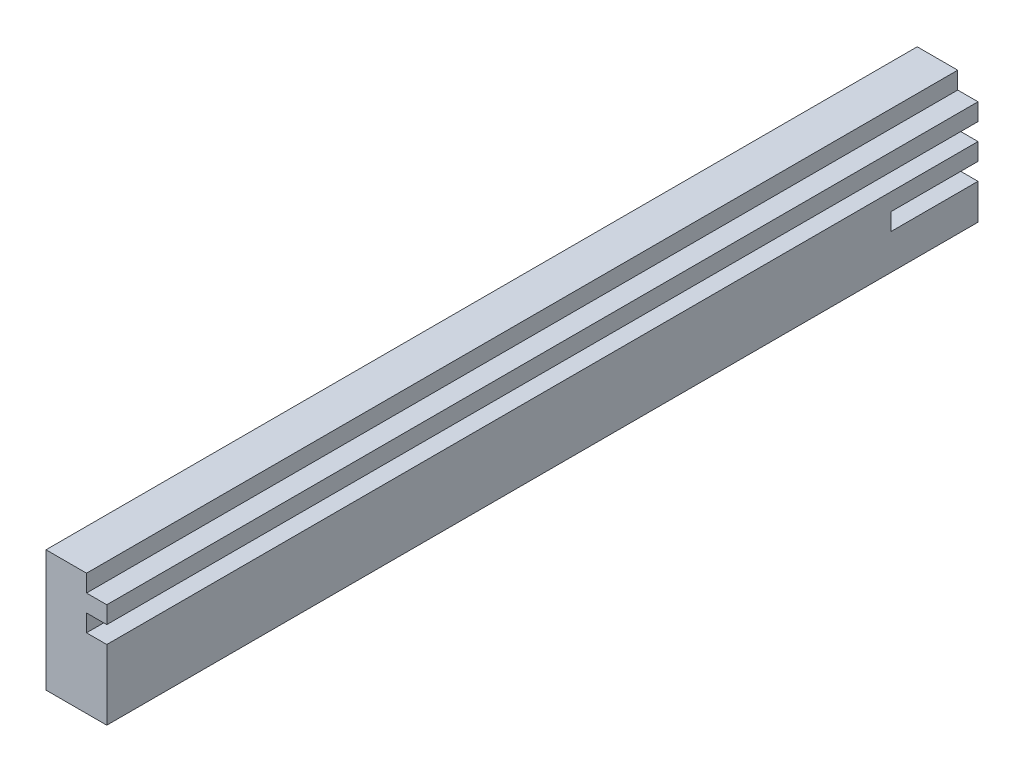
from build123d import *

# Parameters (mm, degrees)
SKETCH1_W           = 430
SKETCH1_H           = 60
BOSS_EXTRUDE1_DEPTH = 30
SKETCH2_W           = 430
SKETCH2_H           = 8.5
SKETCH2_W_2         = 42.888451377
CUT_EXTRUDE1_DEPTH  = 10


with BuildPart() as part:
    # Sketch1 → Boss-Extrude1 (new body)
    with BuildSketch(Plane(origin=(0, 0, 0), x_dir=(0, 0, -1), z_dir=(1, 0, 0))):
        with Locations((215, 30)):
            Rectangle(SKETCH1_W, SKETCH1_H)
    extrude(amount=BOSS_EXTRUDE1_DEPTH)

    # Sketch2 → Cut-Extrude1 (cut)
    with BuildSketch(Plane(origin=(30, 0, 0), x_dir=(0, 0, -1), z_dir=(1, 0, 0))):
        with Locations((215, 55.75)):
            Rectangle(SKETCH2_W, SKETCH2_H)
        with Locations((215, 38.75)):
            Rectangle(SKETCH2_W, SKETCH2_H)
        with Locations((408.555774312, 21.75)):
            Rectangle(SKETCH2_W_2, SKETCH2_H)
    extrude(amount=-CUT_EXTRUDE1_DEPTH, mode=Mode.SUBTRACT)


solid = part.part
